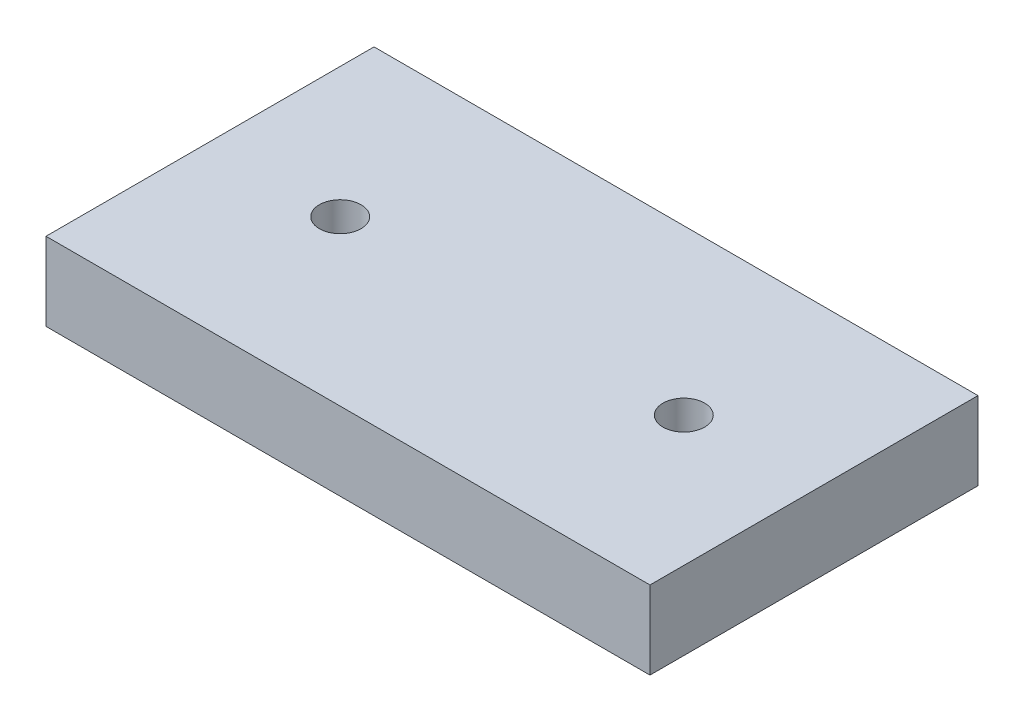
from build123d import *

# Parameters (mm, degrees)
CROQUIS1_W              = 116
CROQUIS1_H              = 63
CROQUIS1_R              = 4
SALIENTE_EXTRUIR1_DEPTH = 15


with BuildPart() as part:
    # Croquis1 → Saliente-Extruir1 (new body)
    with BuildSketch(Plane(origin=(0, 0, 0), x_dir=(1, 0, 0), z_dir=(0, 1, 0))):
        with Locations((58, 31.5)):
            Rectangle(CROQUIS1_W, CROQUIS1_H)
        with Locations(Location((25, 31.5, 0), (0, 0, 270))):
            Circle(CROQUIS1_R, mode=Mode.SUBTRACT)
        with Locations(Location((91, 31.5, 0), (0, 0, 270))):
            Circle(CROQUIS1_R, mode=Mode.SUBTRACT)
    extrude(amount=SALIENTE_EXTRUIR1_DEPTH)


solid = part.part
